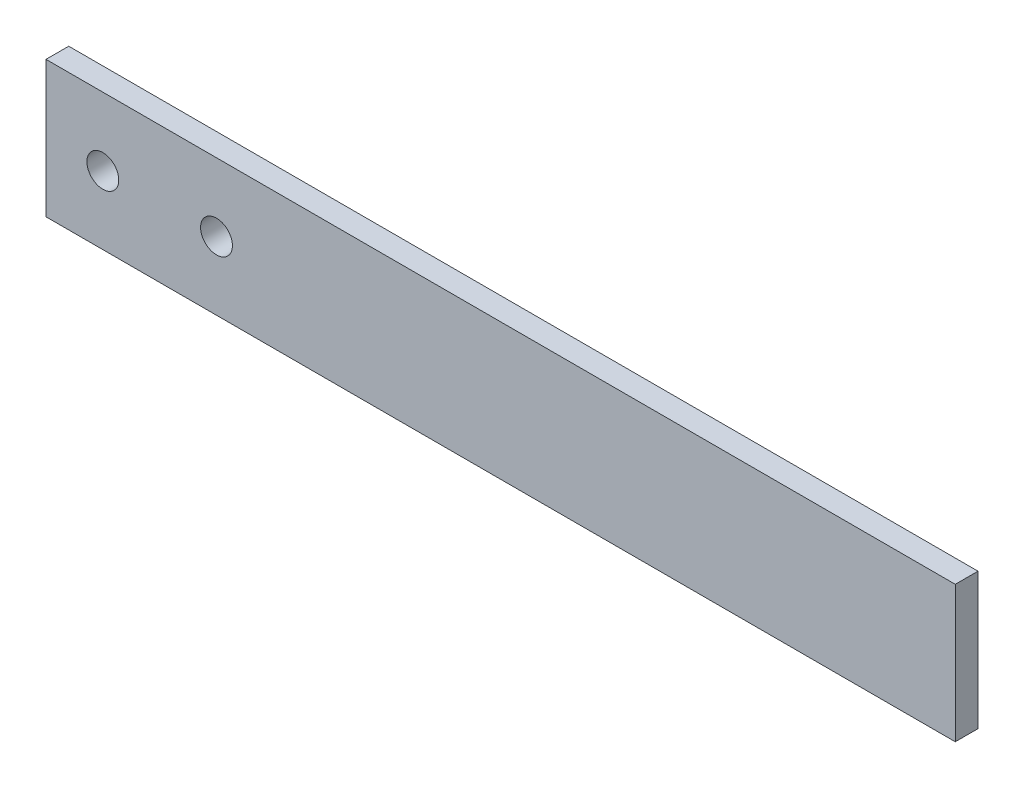
from build123d import *

# Parameters (mm, degrees)
SKETCH1_W           = 400
SKETCH1_H           = 60
BOSS_EXTRUDE1_DEPTH = 10
SKETCH2_R           = 7
CUT_EXTRUDE1_DEPTH  = 10


with BuildPart() as part:
    # Sketch1 → Boss-Extrude1 (new body)
    with BuildSketch(Plane.XY):
        Rectangle(SKETCH1_W, SKETCH1_H)
    extrude(amount=BOSS_EXTRUDE1_DEPTH)

    # Sketch2 → Cut-Extrude1 (cut)
    with BuildSketch(Plane.XY.offset(10)):
        with Locations((-175, 0)):
            Circle(SKETCH2_R)
        with Locations((-125, 0)):
            Circle(SKETCH2_R)
    extrude(amount=-CUT_EXTRUDE1_DEPTH, mode=Mode.SUBTRACT)


solid = part.part
